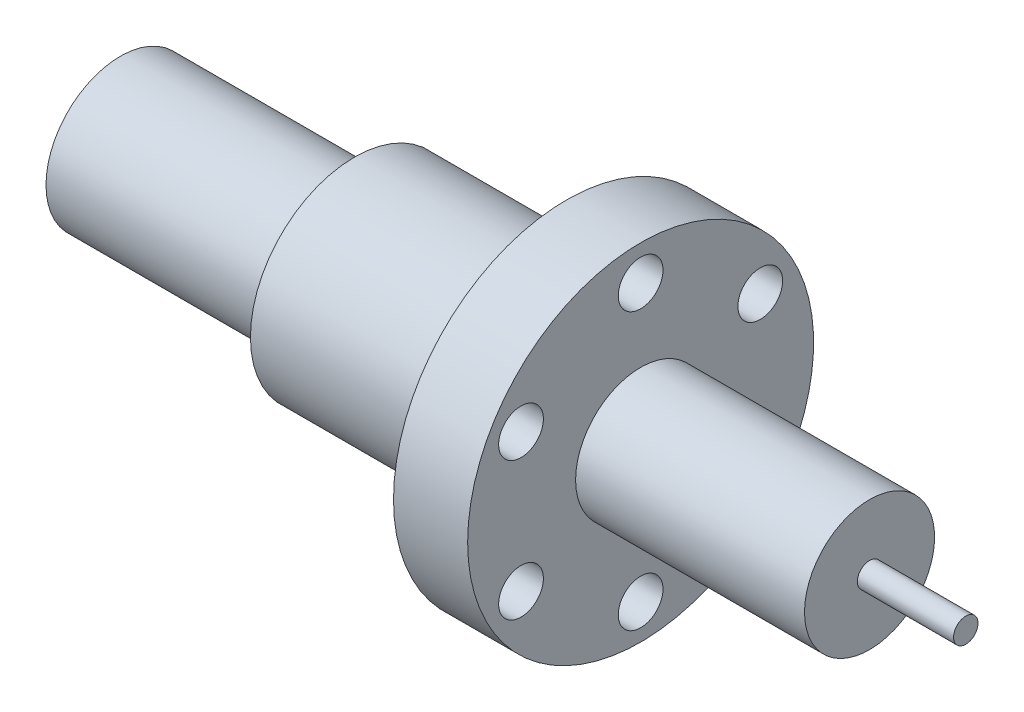
from build123d import *

# Parameters (mm, degrees)
SKETCH2_R         = 2.1844
EXTRUDE1_DEPTH    = 57.136011276
CIRPATTERN1_COUNT = 6
SKETCH3_R         = 10.16
SKETCH3_R_2       = 7.261095031
EXTRUDE2_DEPTH    = 22.86


with BuildPart() as part:
    # Sketch1 → Revolve1 (revolve)
    with BuildSketch(Plane.XY, mode=Mode.PRIVATE) as revolve1_sk:
        Polygon((31.75, 0), (31.75, 1.1938), (22.352, 1.1938), (22.352, 6.35), (0, 6.35), (0, 16.891), (-7.239, 16.891), (-7.239, 10.16), (-50.8, 10.16), (-50.8, 0), align=None)
    revolve(revolve1_sk.sketch.rotate(Axis((-40.728426743, 0, 0), (1, 0, 0)), 90), axis=Axis((-40.728426743, 0, 0), (1, 0, 0)))

    # Sketch2 → Extrude1 (cut, through all)
    with BuildSketch(Plane(origin=(0, 0, 0), x_dir=(0, 0, -1), z_dir=(1, 0, 0))):
        with Locations((0, 13.4874)):
            Circle(SKETCH2_R)
    extrude1 = extrude(amount=-EXTRUDE1_DEPTH, mode=Mode.SUBTRACT)

    # CirPattern1: Extrude1 ×6 about axis
    cirpattern1_axis = Axis((0, 0, 0), (1, 0, 0))
    for i in range(1, CIRPATTERN1_COUNT):
        add(extrude1.rotate(cirpattern1_axis, i * 360 / CIRPATTERN1_COUNT), mode=Mode.SUBTRACT)

    # Sketch3 → Extrude2 (cut)
    with BuildSketch(Plane.ZY.offset(50.8)):
        Circle(SKETCH3_R)
        Circle(SKETCH3_R_2, mode=Mode.SUBTRACT)
    extrude(amount=-EXTRUDE2_DEPTH, mode=Mode.SUBTRACT)


solid = part.part
